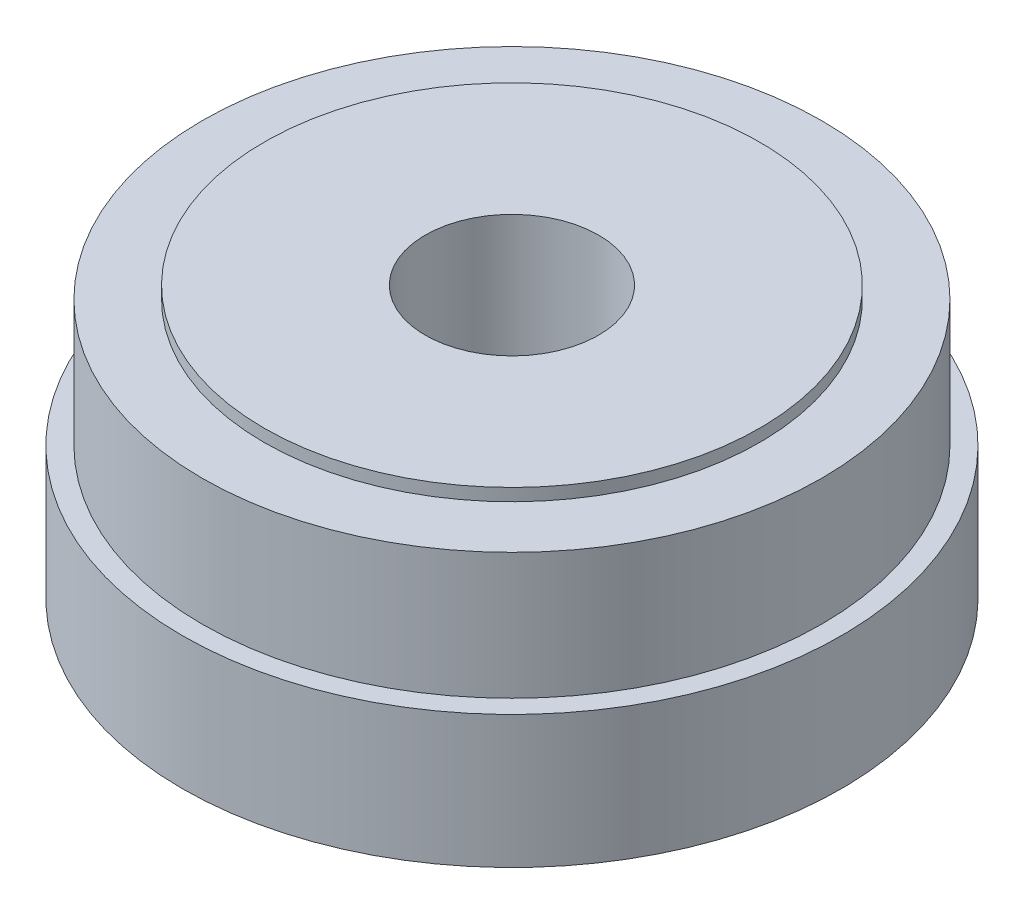
from build123d import *

# Parameters (mm, degrees)
SKETCH1_R           = 133
BOSS_EXTRUDE1_DEPTH = 53.5
SKETCH2_R           = 125
BOSS_EXTRUDE2_DEPTH = 51
SKETCH3_R           = 100
BOSS_EXTRUDE3_DEPTH = 5
SKETCH4_R           = 106
BOSS_EXTRUDE4_DEPTH = 12
SKETCH5_R           = 60
BOSS_EXTRUDE5_DEPTH = 11
SKETCH6_R           = 35
CUT_EXTRUDE1_DEPTH  = 231.074444474


with BuildPart() as part:
    # Sketch1 → Boss-Extrude1 (new body)
    with BuildSketch(Plane(origin=(0, 0, 0), x_dir=(1, 0, 0), z_dir=(0, 1, 0))):
        with Locations(Location((0, 0, 0), (0, 0, 270))):
            Circle(SKETCH1_R)
    extrude(amount=BOSS_EXTRUDE1_DEPTH)

    # Sketch2 → Boss-Extrude2 (add)
    with BuildSketch(Plane(origin=(0, 53.5, 0), x_dir=(1, 0, 0), z_dir=(0, 1, 0))):
        with Locations(Location((0, 0, 0), (0, 0, 270))):
            Circle(SKETCH2_R)
    extrude(amount=BOSS_EXTRUDE2_DEPTH)

    # Sketch3 → Boss-Extrude3 (add)
    with BuildSketch(Plane(origin=(0, 104.5, 0), x_dir=(1, 0, 0), z_dir=(0, 1, 0))):
        with Locations(Location((0, 0, 0), (0, 0, 270))):
            Circle(SKETCH3_R)
    extrude(amount=BOSS_EXTRUDE3_DEPTH)

    # Sketch4 → Boss-Extrude4 (add)
    with BuildSketch(Plane.XZ):
        with Locations(Location((0, 0, 0), (0, 0, 270))):
            Circle(SKETCH4_R)
    extrude(amount=BOSS_EXTRUDE4_DEPTH)

    # Sketch5 → Boss-Extrude5 (add)
    with BuildSketch(Plane.XZ.offset(12)):
        with Locations(Location((0, 0, 0), (0, 0, 270))):
            Circle(SKETCH5_R)
    extrude(amount=BOSS_EXTRUDE5_DEPTH)

    # Sketch6 → Cut-Extrude1 (cut, through all)
    with BuildSketch(Plane.XZ.offset(23)):
        with Locations(Location((0, 0, 0), (0, 0, 270))):
            Circle(SKETCH6_R)
    extrude(amount=-CUT_EXTRUDE1_DEPTH, mode=Mode.SUBTRACT)


solid = part.part
